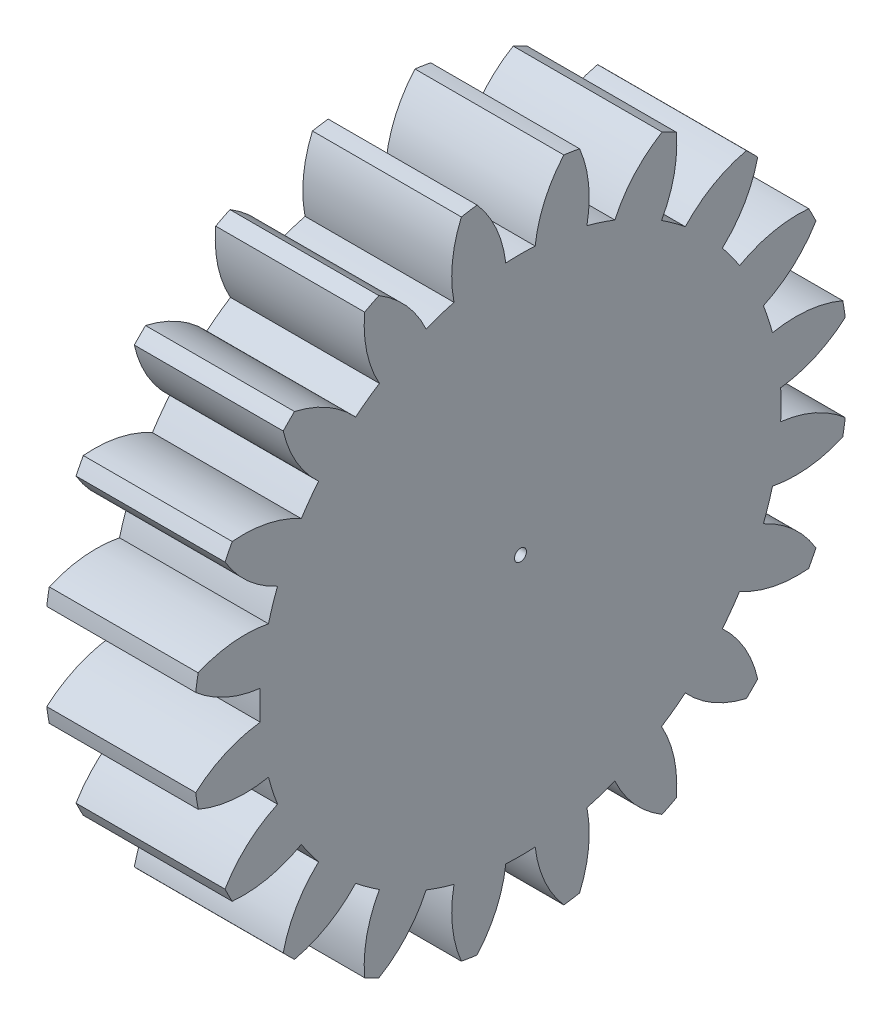
from build123d import *

# Parameters (mm, degrees)
BASPROSKE_W     = 10
BASPROSKE_H     = 22
TOOTHCUT_DEPTH  = 33.680269277
TEETHCUTS_COUNT = 20
TEETHCUTS_ANGLE = 342
BORSKE_R        = 0.4
BORE_DEPTH      = 50.0000508


with BuildPart() as part:
    # BasProSke → Base-Revolve (revolve)
    with BuildSketch(Plane(origin=(0, 0, 0), x_dir=(1, 0, 0), z_dir=(0, 1, 0)), mode=Mode.PRIVATE) as base_revolve_sk:
        with Locations((5, 11)):
            Rectangle(BASPROSKE_W, BASPROSKE_H)
    revolve(base_revolve_sk.sketch.rotate(Axis((-10, 0, 0), (1, 0, 0)), 180), axis=Axis((-10, 0, 0), (1, 0, 0)))

    # TooCutSke → ToothCut (cut, through all)
    with BuildSketch(Plane(origin=(0, 0, 0), x_dir=(0, 0, -1), z_dir=(1, 0, 0))):
        with BuildLine():
            ThreePointArc((0.986171591, 17.471189616), (0, 17.499), (-0.986171591, 17.471189616))
            ThreePointArc((-0.986171591, 17.471189616), (-1.626916196, 19.798789858), (-2.932850173, 21.829260982))
            ThreePointArc((-2.932850173, 21.829260982), (0, 22.0254), (2.932850173, 21.829260982))
            ThreePointArc((2.932850173, 21.829260982), (1.626916196, 19.798789858), (0.986171591, 17.471189616))
        make_face()
    toothcut = extrude(amount=TOOTHCUT_DEPTH, mode=Mode.SUBTRACT)

    # TeethCuts: ToothCut ×20 about axis
    teethcuts_axis = Axis((-10, 0, 0), (1, 0, 0))
    for i in range(1, TEETHCUTS_COUNT):
        add(toothcut.rotate(teethcuts_axis, i * TEETHCUTS_ANGLE / (TEETHCUTS_COUNT - 1)), mode=Mode.SUBTRACT)

    # BorSke → Bore (cut, symmetric)
    with BuildSketch(Plane(origin=(0, 0, 0), x_dir=(0, 0, -1), z_dir=(1, 0, 0))):
        with Locations(Location((0, 0, 0), (0, 0, 180))):
            Circle(BORSKE_R)
    extrude(amount=BORE_DEPTH, both=True, mode=Mode.SUBTRACT)


solid = part.part
